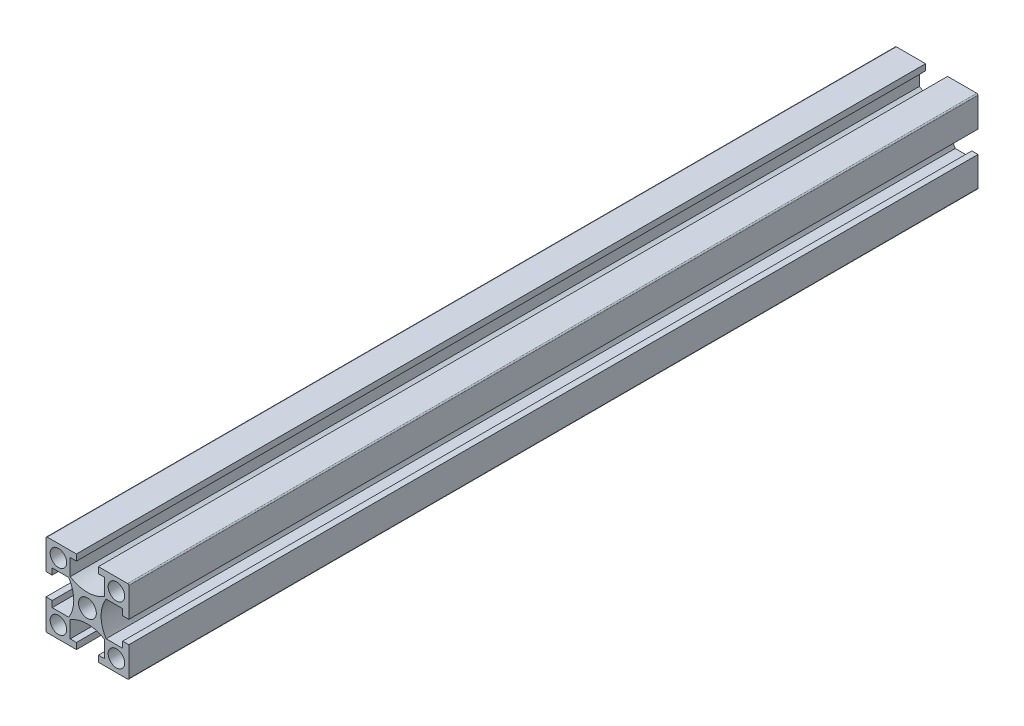
from build123d import *

# Parameters (mm, degrees)
SKETCH_1_W               = 20
SKETCH_1_H               = 20
SKETCH_1_R               = 2
SKETCH_1_R_2             = 2.15
EXTRUDE_1_DEPTH          = 205
CUT_EXTRUDE_1_REACH      = 207.487
PATTERN_CIRCULAR_1_COUNT = 4
FILLET_1_R               = 0.3


with BuildPart() as part:
    # 스케치1 → 보스-돌출1 (new body)
    with BuildSketch(Plane.XY):
        Rectangle(SKETCH_1_W, SKETCH_1_H)
        with Locations((-7, -7)):
            Circle(SKETCH_1_R, mode=Mode.SUBTRACT)
        with Locations((7, -7)):
            Circle(SKETCH_1_R, mode=Mode.SUBTRACT)
        with Locations((-7, 7)):
            Circle(SKETCH_1_R, mode=Mode.SUBTRACT)
        Circle(SKETCH_1_R_2, mode=Mode.SUBTRACT)
        with Locations((7, 7)):
            Circle(SKETCH_1_R, mode=Mode.SUBTRACT)
    extrude(amount=EXTRUDE_1_DEPTH)

    # 스케치1<3> → 컷-돌출1 (cut, up to next)
    with BuildSketch(Plane.XY, mode=Mode.PRIVATE) as cut_extrude_1_sk1:
        with BuildLine():
            Line((-8.5, 2.65), (-10, 2.65))
            Line((-10, 2.65), (-10, -2.65))
            Line((-10, -2.65), (-8.5, -2.65))
            Line((-8.5, -2.65), (-8.5, -4.15))
            Line((-8.5, -4.15), (-4.503166667, -4.15))
            ThreePointArc((-4.503166667, -4.15), (-3.3, 0), (-4.503166667, 4.15))
            Line((-4.503166667, 4.15), (-8.5, 4.15))
            Line((-8.5, 4.15), (-8.5, 2.65))
        make_face()
    cut_extrude_1_tool1 = extrude(cut_extrude_1_sk1.sketch, amount=CUT_EXTRUDE_1_REACH, mode=Mode.PRIVATE) & part.part
    cut_extrude_1 = cut_extrude_1_tool1.solids().sort_by_distance((-6.606913, 0, 0))[0]
    add(cut_extrude_1, mode=Mode.SUBTRACT)

    # 원형 패턴1: 컷-돌출1 ×4 about axis
    pattern_circular_1_axis = Axis((0, 0, 205), (0, 0, -1))
    for i in range(1, PATTERN_CIRCULAR_1_COUNT):
        add(cut_extrude_1.rotate(pattern_circular_1_axis, i * 360 / PATTERN_CIRCULAR_1_COUNT), mode=Mode.SUBTRACT)

    # 필렛1
    fillet_1_edges = [part.edges().sort_by_distance(p)[0] for p in [
        (10, -10, 102.5),
        (-10, -10, 102.5),
        (-10, 10, 102.5),
        (10, 10, 102.5),
    ]]
    fillet(fillet_1_edges, radius=FILLET_1_R)


solid = part.part
